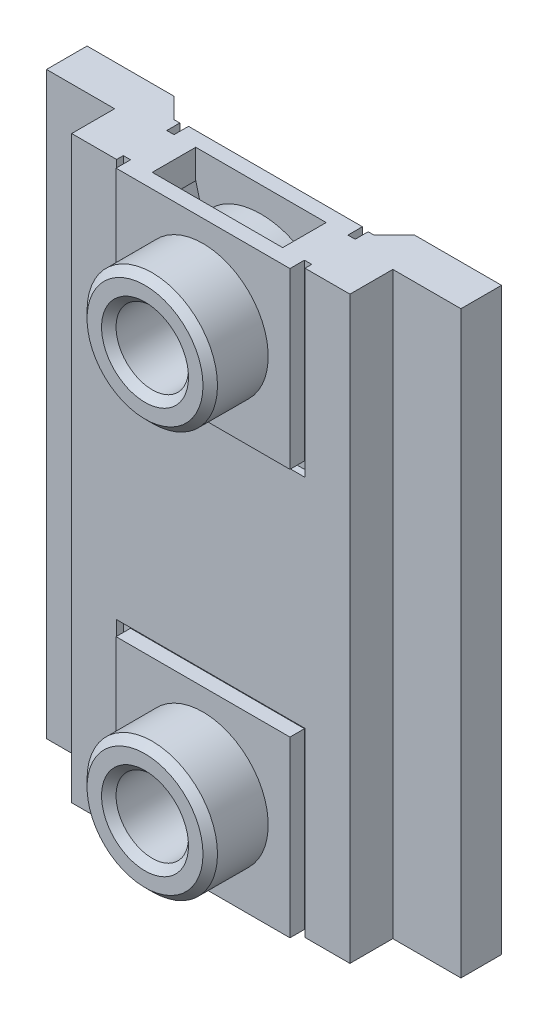
from build123d import *

# Parameters (mm, degrees)
BOSS_EXTRUDE1_DEPTH            = 1.5
SKETCH2_W                      = 4.5
SKETCH2_H                      = 19.25
BOSS_EXTRUDE2_DEPTH            = 1.15
BOSS_EXTRUDE3_DEPTH            = 0.75
SKETCH4_W                      = 2.65
SKETCH4_H                      = 20
BOSS_EXTRUDE4_DEPTH            = 4.9
SKETCH5_W                      = 2.65
SKETCH5_H                      = 20
BOSS_EXTRUDE5_DEPTH            = 4.9
SKETCH6_W                      = 14.3
SKETCH6_H                      = 20
BOSS_EXTRUDE6_DEPTH            = 0.23
SKETCH7_W                      = 6.9
SKETCH7_H                      = 0.7
CUT_EXTRUDE1_DEPTH             = 22.99898649
CUT_EXTRUDE2_REACH             = 18.523
CUT_EXTRUDE3_REACH             = 18.523
SKETCH12_W                     = 6.5
SKETCH12_H                     = 0.23
CUT_EXTRUDE4_DEPTH             = 6.25
SKETCH13_W                     = 6.5
SKETCH13_H                     = 0.23
CUT_EXTRUDE5_DEPTH             = 6.249995
SKETCH14_W                     = 2.35
SKETCH14_H                     = 1.48
CUT_EXTRUDE6_DEPTH             = 22.99898649
SKETCH15_W                     = 2.35
SKETCH15_H                     = 1.48
CUT_EXTRUDE7_DEPTH             = 22.99898649
SKETCH16_W                     = 5.99999
SKETCH16_H                     = 5.99999
BOSS_EXTRUDE7_DEPTH            = 0.5
SKETCH17_W                     = 5.99999
SKETCH17_H                     = 5.99999
BOSS_EXTRUDE8_DEPTH            = 0.5
SKETCH18_W                     = 5.99999
SKETCH18_H                     = 5.99999
BOSS_EXTRUDE9_DEPTH            = 0.5
SKETCH19_W                     = 5.99999
SKETCH19_H                     = 5.99999
BOSS_EXTRUDE10_DEPTH           = 0.5
DRAFT1_ANGLE                   = 45
SKETCH20_W                     = 2.25
SKETCH20_H                     = 2
SKETCH21_W                     = 2.25
SKETCH21_H                     = 2
F_2_5_2_5_DIAMETER_HOLE1_D     = 2.5
F_2_5_2_5_DIAMETER_HOLE2_D     = 2.5
F_2_5_2_5_DIAMETER_HOLE2_DEPTH = 5.15
CHAMFER1_SIZE                  = 0.25


with BuildPart() as part:
    # Sketch1 → Boss-Extrude1 (new body)
    with BuildSketch(Plane.XY.offset(5.5)):
        with BuildLine():
            Line((1.993599736, -8.043101189), (2.25, -9))
            Line((2.25, -9), (2.25, 9))
            Line((2.25, 9), (1.993599736, 8.043101189))
            add(Edge.make_bspline(
                [(-1.993599736, 8.043101189), (-1.236487805, 9.490111472), (1.236487805, 9.490111472), (1.993599736, 8.043101189)],
                knots=[0, 0, 0, 0, 1, 1, 1, 1], degree=3))
            Line((-1.993599736, 8.043101189), (-2.25, 9))
            Line((-2.25, 9), (-2.25, -9))
            Line((-2.25, -9), (-1.993599736, -8.043101189))
            add(Edge.make_bspline(
                [(1.993599736, -8.043101189), (1.236487805, -9.490111472), (-1.236487805, -9.490111472), (-1.993599736, -8.043101189)],
                knots=[0, 0, 0, 0, 1, 1, 1, 1], degree=3))
        make_face()
    extrude(amount=-BOSS_EXTRUDE1_DEPTH)

    # Sketch2 → Boss-Extrude2 (add)
    with BuildSketch(Plane(origin=(0, 0, 4), x_dir=(-1, 0, 0), z_dir=(0, 0, -1))):
        with Locations((0, 0.375)):
            Rectangle(SKETCH2_W, SKETCH2_H)
    extrude(amount=BOSS_EXTRUDE2_DEPTH)

    # Sketch3 → Boss-Extrude3 (add)
    with BuildSketch(Plane.XZ.offset(9.25)):
        with BuildLine():
            Line((2.25, 2.85), (-2.25, 2.85))
            Line((-2.25, 2.85), (-2.25, 4))
            add(Edge.make_bspline(
                [(2.25, 4), (0.75, 4), (-0.75, 4), (-2.25, 4)],
                knots=[0, 0, 0, 0, 1, 1, 1, 1], degree=3))
            Line((2.25, 4), (2.25, 2.85))
        make_face()
    extrude(amount=BOSS_EXTRUDE3_DEPTH)

    # Sketch4 → Boss-Extrude4 (add)
    with BuildSketch(Plane(origin=(2.25, 0, 0), x_dir=(0, 0, -1), z_dir=(1, 0, 0))):
        with Locations((-4.175, 0)):
            Rectangle(SKETCH4_W, SKETCH4_H)
    extrude(amount=BOSS_EXTRUDE4_DEPTH)

    # Sketch5 → Boss-Extrude5 (add)
    with BuildSketch(Plane.ZY.offset(2.25)):
        with Locations((4.175, 0)):
            Rectangle(SKETCH5_W, SKETCH5_H)
    extrude(amount=BOSS_EXTRUDE5_DEPTH)

    # Sketch6 → Boss-Extrude6 (add)
    with BuildSketch(Plane.XY.offset(5.5)):
        Rectangle(SKETCH6_W, SKETCH6_H)
    extrude(amount=BOSS_EXTRUDE6_DEPTH)

    # Sketch7 → Cut-Extrude1 (cut, through all)
    with BuildSketch(Plane.XZ.offset(10)):
        with Locations((0, 3.2)):
            Rectangle(SKETCH7_W, SKETCH7_H)
    extrude(amount=-CUT_EXTRUDE1_DEPTH, mode=Mode.SUBTRACT)

    # Sketch9 → Cut-Extrude2 (cut, up to next)
    with BuildSketch(Plane(origin=(0, -3.75, 0), x_dir=(1, 0, 0), z_dir=(0, 1, 0)), mode=Mode.PRIVATE) as cut_extrude2_sk1:
        with BuildLine():
            Line((3.25, -4), (3.25, -3.55))
            Line((3.25, -3.55), (-3.25, -3.55))
            Line((-3.25, -3.55), (-3.25, -4))
            add(Edge.make_bspline(
                [(3.25, -4), (1.083333333, -4), (-1.083333333, -4), (-3.25, -4)],
                knots=[0, 0, 0, 0, 1, 1, 1, 1], degree=3))
        make_face()
    cut_extrude2_tool1 = extrude(cut_extrude2_sk1.sketch, amount=-CUT_EXTRUDE2_REACH, mode=Mode.PRIVATE) & part.part
    add(cut_extrude2_tool1.solids().sort_by_distance((0, -3.75, 3.775))[0], mode=Mode.SUBTRACT)

    # Sketch11 → Cut-Extrude3 (cut, up to next)
    with BuildSketch(Plane.XZ.offset(-3.75), mode=Mode.PRIVATE) as cut_extrude3_sk1:
        with BuildLine():
            Line((-3.25, 4), (-3.25, 3.55))
            Line((-3.25, 3.55), (3.25, 3.55))
            Line((3.25, 3.55), (3.25, 4))
            add(Edge.make_bspline(
                [(-3.25, 4), (-1.083333333, 4), (1.083333333, 4), (3.25, 4)],
                knots=[0, 0, 0, 0, 1, 1, 1, 1], degree=3))
        make_face()
    cut_extrude3_tool1 = extrude(cut_extrude3_sk1.sketch, amount=-CUT_EXTRUDE3_REACH, mode=Mode.PRIVATE) & part.part
    add(cut_extrude3_tool1.solids().sort_by_distance((0, 3.75, 3.775))[0], mode=Mode.SUBTRACT)

    # Sketch12 → Cut-Extrude4 (cut)
    with BuildSketch(Plane(origin=(0, 10, 0), x_dir=(-1, 0, 0), z_dir=(0, 1, 0))):
        with Locations((0, 5.615)):
            Rectangle(SKETCH12_W, SKETCH12_H)
    extrude(amount=-CUT_EXTRUDE4_DEPTH, mode=Mode.SUBTRACT)

    # Sketch13 → Cut-Extrude5 (cut)
    with BuildSketch(Plane.XZ.offset(10)):
        with Locations((0, 5.615)):
            Rectangle(SKETCH13_W, SKETCH13_H)
    extrude(amount=-CUT_EXTRUDE5_DEPTH, mode=Mode.SUBTRACT)

    # Sketch14 → Cut-Extrude6 (cut, through all)
    with BuildSketch(Plane(origin=(0, 10, 0), x_dir=(-1, 0, 0), z_dir=(0, 1, 0))):
        with Locations((5.975, 4.99)):
            Rectangle(SKETCH14_W, SKETCH14_H)
    extrude(amount=-CUT_EXTRUDE6_DEPTH, mode=Mode.SUBTRACT)

    # Sketch15 → Cut-Extrude7 (cut, through all)
    with BuildSketch(Plane(origin=(0, 10, 0), x_dir=(-1, 0, 0), z_dir=(0, 1, 0))):
        with Locations((-5.975, 4.99)):
            Rectangle(SKETCH15_W, SKETCH15_H)
    extrude(amount=-CUT_EXTRUDE7_DEPTH, mode=Mode.SUBTRACT)

    # Sketch16 → Boss-Extrude7 (add)
    with BuildSketch(Plane(origin=(0, 0, 4), x_dir=(-1, 0, 0), z_dir=(0, 0, -1))):
        with Locations((0, 7)):
            Rectangle(SKETCH16_W, SKETCH16_H)
    extrude(amount=BOSS_EXTRUDE7_DEPTH)

    # Sketch17 → Boss-Extrude8 (add)
    with BuildSketch(Plane.XY.offset(5.5)):
        with Locations((0, 7)):
            Rectangle(SKETCH17_W, SKETCH17_H)
    extrude(amount=BOSS_EXTRUDE8_DEPTH)

    # Sketch18 → Boss-Extrude9 (add)
    with BuildSketch(Plane(origin=(0, 0, 4), x_dir=(-1, 0, 0), z_dir=(0, 0, -1))):
        with Locations((0, -7)):
            Rectangle(SKETCH18_W, SKETCH18_H)
    extrude(amount=BOSS_EXTRUDE9_DEPTH)

    # Sketch19 → Boss-Extrude10 (add)
    with BuildSketch(Plane.XY.offset(5.5)):
        with Locations((0, -7)):
            Rectangle(SKETCH19_W, SKETCH19_H)
    extrude(amount=BOSS_EXTRUDE10_DEPTH)

    # Draft1
    draft1_faces = [part.faces().sort_by_distance(p)[0] for p in [
        (-3.45, 0, 3.2),
        (3.45, 0, 3.2),
    ]]
    draft(draft1_faces, Plane(origin=(3.45, 10, 3.55), x_dir=(-1, 0, 0), z_dir=(0, 0, -1)), DRAFT1_ANGLE)

    # Sketch20 → Revolve1 (revolve)
    with BuildSketch(Plane.XZ.offset(7), mode=Mode.PRIVATE) as revolve1_sk:
        with Locations((1.125, 7)):
            Rectangle(SKETCH20_W, SKETCH20_H)
    revolve(revolve1_sk.sketch.rotate(Axis((0, -7, 8.000025), (0, 0, -1)), 180), axis=Axis((0, -7, 8.000025), (0, 0, -1)))

    # Sketch21 → Revolve2 (revolve)
    with BuildSketch(Plane.XZ.offset(-7), mode=Mode.PRIVATE) as revolve2_sk:
        with Locations((1.125, 7)):
            Rectangle(SKETCH21_W, SKETCH21_H)
    revolve(revolve2_sk.sketch.rotate(Axis((0, 7, 8.000025), (0, 0, -1)), 180), axis=Axis((0, 7, 8.000025), (0, 0, -1)))

    # Ø2.5 (2.5) Diameter Hole1 (through all)
    with Locations(Plane(origin=(0, 0, 3.5), x_dir=(-1, 0, 0), z_dir=(0, 0, -1))):
        with Locations((0, -7)):
            Hole(F_2_5_2_5_DIAMETER_HOLE1_D / 2)

    # Ø2.5 (2.5) Diameter Hole2
    with Locations(Plane.XY.offset(8)):
        with Locations((0, 7)):
            Hole(F_2_5_2_5_DIAMETER_HOLE2_D / 2, depth=F_2_5_2_5_DIAMETER_HOLE2_DEPTH)

    # Chamfer1
    chamfer1_edges = [part.edges().sort_by_distance(p)[0] for p in [
        (2.25, -7, 8),
        (2.25, 7, 8),
        (-1.25, -7, 3.5),
        (-1.25, -7, 8),
        (1.25, 7, 3.5),
        (1.25, 7, 8),
    ]]
    chamfer(chamfer1_edges, length=CHAMFER1_SIZE)


solid = part.part
